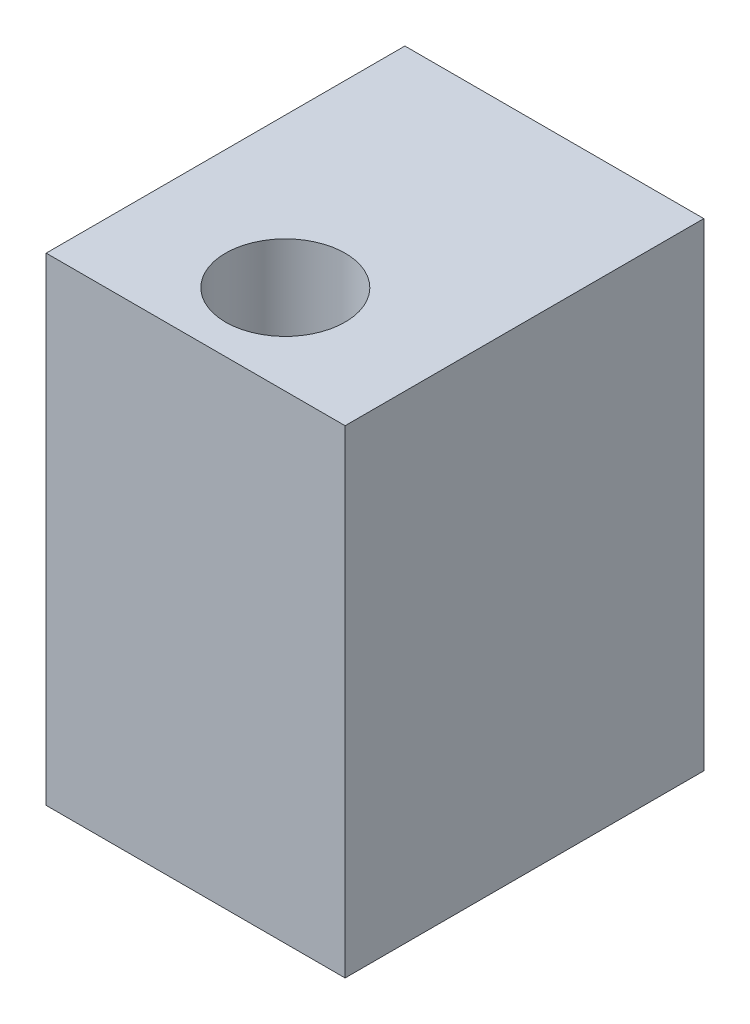
from build123d import *

# Parameters (mm, degrees)
SKETCH1_W           = 10
SKETCH1_H           = 12
BOSS_EXTRUDE1_DEPTH = 16
SKETCH2_R           = 1.5
CUT_EXTRUDE1_DEPTH  = 16
SKETCH2_3_R         = 2
CUT_EXTRUDE2_DEPTH  = 8


with BuildPart() as part:
    # Sketch1 → Boss-Extrude1 (new body)
    with BuildSketch(Plane(origin=(0, 0, 0), x_dir=(1, 0, 0), z_dir=(0, 1, 0))):
        Rectangle(SKETCH1_W, SKETCH1_H)
    extrude(amount=BOSS_EXTRUDE1_DEPTH)

    # Sketch2 → Cut-Extrude1 (cut)
    with BuildSketch(Plane(origin=(0, 16, 0), x_dir=(1, 0, 0), z_dir=(0, 1, 0))):
        with Locations((0, -3)):
            Circle(SKETCH2_R)
    extrude(amount=-CUT_EXTRUDE1_DEPTH, mode=Mode.SUBTRACT)

    # Sketch2<3> → Cut-Extrude2 (cut)
    with BuildSketch(Plane(origin=(0, 16, 0), x_dir=(1, 0, 0), z_dir=(0, 1, 0))):
        with Locations((0, -3)):
            Circle(SKETCH2_3_R)
    extrude(amount=-CUT_EXTRUDE2_DEPTH, mode=Mode.SUBTRACT)


solid = part.part
